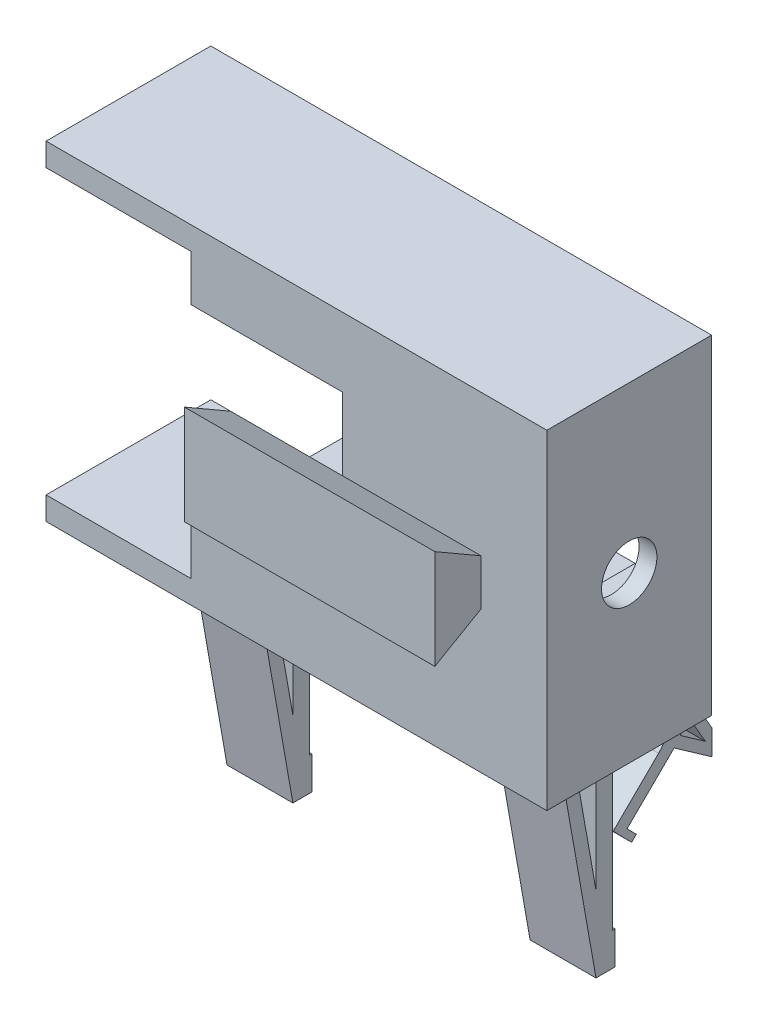
from build123d import *

# Parameters (mm, degrees)
SKETCH1_W                       = 38
SKETCH1_H                       = 50
BOSS_EXTRUDE1_DEPTH             = 25
BOSS_EXTRUDE8_DEPTH             = 10
FILLET1_R                       = 0.3
FILLET1_OF_MIRROR1_R            = 0.3
CUT_EXTRUDE7_REACH              = 77.873
SKETCH15_W                      = 45
SKETCH15_H                      = 29
BOSS_EXTRUDE2_DEPTH             = 38
SKETCH16_R                      = 11.1
CUT_EXTRUDE8_DEPTH              = 3.5
SKETCH17_R                      = 6.05
CUT_EXTRUDE9_DEPTH              = 19
CUT_EXTRUDE10_DEPTH             = 5.8
CUT_EXTRUDE11_START             = -15.8
CUT_EXTRUDE11_DEPTH             = 15.8
SKETCH20_R                      = 1.85
CUT_EXTRUDE12_DEPTH             = 19
CIRPATTERN1_COUNT               = 2
CIRPATTERN1_ANGLE               = 90
CIRPATTERN1_THE_OTHER_WAY_COUNT = 2
CIRPATTERN1_THE_OTHER_WAY_ANGLE = 90
SKETCH24_W                      = 15.3
SKETCH24_H                      = 21.6
SKETCH24_R                      = 1.85
CUT_EXTRUDE13_DEPTH             = 16
SKETCH25_R                      = 4.2
CUT_EXTRUDE14_DEPTH             = 101.421935127
SKETCH27_W                      = 22
SKETCH27_H                      = 43
CUT_EXTRUDE15_DEPTH             = 25


with BuildPart() as part:
    # Sketch1 → Boss-Extrude1 (new body)
    with BuildSketch(Plane.XY):
        with Locations((-19, 0)):
            Rectangle(SKETCH1_W, SKETCH1_H)
    boss_extrude1 = extrude(amount=BOSS_EXTRUDE1_DEPTH)

    # Sketch11 → Boss-Extrude8 (add)
    with BuildSketch(Plane(origin=(-28, 0, 0), x_dir=(0, 0, -1), z_dir=(1, 0, 0))):
        with BuildLine():
            Line((-5.0442209, -55.726230367), (-5.0442209, -29.776230367))
            ThreePointArc((-5.0442209, -29.776230367), (-4.776271708, -28.776230367), (-4.0442209, -28.044179559))
            ThreePointArc((-4.0442209, -28.044179559), (2.432940548, -29.34409424), (1.9670283, -35.933959519))
            Line((1.9670283, -35.933959519), (-4.9442209, -42.751230367))
            Line((-4.9442209, -42.751230367), (-2.13522154, -45.598952719))
            Line((-2.13522154, -45.598952719), (-1.423290952, -44.896702879))
            Line((-1.423290952, -44.896702879), (-2.827790632, -43.472841703))
            Line((-2.827790632, -43.472841703), (4.31462396, -36.427548823))
            Line((4.31462396, -36.427548823), (10.04868827, -40.442583877))
            Line((10.04868827, -40.442583877), (10.04868827, -36.637851334))
            Line((10.04868827, -36.637851334), (5.379165125, -28.55))
            ThreePointArc((5.379165125, -28.55), (3.107671966, -26.234387817), (0, -25.304809472))
            Line((0, -25.304809472), (0, -25))
            Line((0, -25), (-0.5, -25))
            Line((-0.5, -25), (-0.5, -25.304809472))
            ThreePointArc((-0.5, -25.304809472), (-2.379635768, -25.65877443), (-4.074871702, -26.544492749))
            ThreePointArc((-4.074871702, -26.544492749), (-5.891365223, -28.673957334), (-6.5442209, -31.395730211))
            Line((-6.5442209, -31.395730211), (-6.5442209, -25))
            Line((-6.5442209, -25), (-7.5442209, -25))
            Line((-7.5442209, -25), (-7.5442209, -49.208689401))
            Line((-7.5442209, -49.208689401), (-11.812866009, -25))
            Line((-11.812866009, -25), (-13.843719233, -25))
            Line((-13.843719233, -25), (-7.5442209, -60.726230367))
            Line((-7.5442209, -60.726230367), (-4.6442209, -60.726230367))
            Line((-4.6442209, -60.726230367), (-4.6442209, -55.726230367))
            Line((-4.6442209, -55.726230367), (-5.0442209, -55.726230367))
        make_face()
        with BuildLine():
            ThreePointArc((5.255569039, -35.255243777), (5.821779814, -34.120234879), (6.156782985, -32.896873642))
            Line((6.156782985, -32.896873642), (9.053935122, -37.914888341))
            Line((9.053935122, -37.914888341), (5.255569039, -35.255243777))
        make_face(mode=Mode.SUBTRACT)
    boss_extrude8 = extrude(amount=BOSS_EXTRUDE8_DEPTH)

    # Fillet1
    fillet1_edges = [part.edges().sort_by_distance(p)[0] for p in [
        (-23, -42.751230367, 4.9442209),
    ]]
    fillet(fillet1_edges, radius=FILLET1_R)

    # Mirror1: Boss-Extrude1, Boss-Extrude8 across plane
    add(boss_extrude1.mirror(Plane(origin=(0, 0, 0), x_dir=(0, 0, 1), z_dir=(1, 0, 0))))
    add(boss_extrude8.mirror(Plane(origin=(0, 0, 0), x_dir=(0, 0, 1), z_dir=(1, 0, 0))))

    # Fillet1 of Mirror1
    fillet1_of_mirror1_edges = [part.edges().sort_by_distance(p)[0] for p in [
        (23, -42.751230367, 4.9442209),
    ]]
    fillet(fillet1_of_mirror1_edges, radius=FILLET1_OF_MIRROR1_R)

    # Sketch15 → Cut-Extrude7 (cut, up to next)
    with BuildSketch(Plane(origin=(0, 0, 0), x_dir=(-1, 0, 0), z_dir=(0, 0, -1)), mode=Mode.PRIVATE) as cut_extrude7_sk1:
        with Locations((15.5, 0)):
            Rectangle(SKETCH15_W, SKETCH15_H)
    cut_extrude7_tool1 = extrude(cut_extrude7_sk1.sketch, amount=-CUT_EXTRUDE7_REACH, mode=Mode.PRIVATE) & part.part
    add(cut_extrude7_tool1.solids().sort_by_distance((-15.5, 0, 0))[0], mode=Mode.SUBTRACT)

    # Sketch2 → Boss-Extrude2 (add)
    with BuildSketch(Plane.ZY.offset(-28)):
        Polygon((32, 7.541451884), (25, 3.5), (25, -3.5), (32, -7.541451884), align=None)
    extrude(amount=BOSS_EXTRUDE2_DEPTH)

    # Sketch16 → Cut-Extrude8 (cut)
    with BuildSketch(Plane.ZY.offset(-7)):
        with Locations((12.5, 0)):
            Circle(SKETCH16_R)
    extrude(amount=-CUT_EXTRUDE8_DEPTH, mode=Mode.SUBTRACT)

    # Sketch17 → Cut-Extrude9 (cut)
    with BuildSketch(Plane.ZY.offset(-10.5)):
        with Locations((12.5, 0)):
            Circle(SKETCH17_R)
    extrude(amount=-CUT_EXTRUDE9_DEPTH, mode=Mode.SUBTRACT)

    # Sketch18 → Cut-Extrude10 (cut)
    with BuildSketch(Plane.ZY.offset(-29.5)):
        with BuildLine():
            Line((0, -7.5), (12.5, -7.5))
            ThreePointArc((12.5, -7.5), (20, 0), (12.5, 7.5))
            Line((12.5, 7.5), (0, 7.5))
            Line((0, 7.5), (0, -7.5))
        make_face()
    extrude(amount=-CUT_EXTRUDE10_DEPTH, mode=Mode.SUBTRACT)

    # Sketch19 → Cut-Extrude11 (cut)
    with BuildSketch(Plane(origin=(29.5, 0, 0), x_dir=(0, 0, -1), z_dir=(1, 0, 0)).offset(CUT_EXTRUDE11_START)):
        with BuildLine():
            Line((-12.5, 6.05), (0, 6.05))
            Line((0, 6.05), (0, -6.05))
            Line((0, -6.05), (-12.5, -6.05))
            ThreePointArc((-12.5, -6.05), (-18.55, 0), (-12.5, 6.05))
        make_face()
    extrude(amount=CUT_EXTRUDE11_DEPTH, mode=Mode.SUBTRACT)

    # Sketch20 → Cut-Extrude12 (cut)
    with BuildSketch(Plane.ZY.offset(-10.5)):
        with Locations((4.5, 0)):
            Circle(SKETCH20_R)
    cut_extrude12 = extrude(amount=-CUT_EXTRUDE12_DEPTH, mode=Mode.SUBTRACT)

    # CirPattern1: Cut-Extrude12 ×2 about axis
    cirpattern1_axis = Axis((29.5, 0, 12.5), (-1, 0, 0))
    for i in range(1, CIRPATTERN1_COUNT):
        add(cut_extrude12.rotate(cirpattern1_axis, i * CIRPATTERN1_ANGLE / (CIRPATTERN1_COUNT - 1)), mode=Mode.SUBTRACT)

    # CirPattern1 the other way: Cut-Extrude12 ×2 about axis
    cirpattern1_the_other_way_axis = Axis((29.5, 0, 12.5), (1, 0, 0))
    for i in range(1, CIRPATTERN1_THE_OTHER_WAY_COUNT):
        add(cut_extrude12.rotate(cirpattern1_the_other_way_axis, i * CIRPATTERN1_THE_OTHER_WAY_ANGLE / (CIRPATTERN1_THE_OTHER_WAY_COUNT - 1)), mode=Mode.SUBTRACT)

    # Sketch24 → Cut-Extrude13 (cut)
    with BuildSketch(Plane(origin=(13.7, 0, 0), x_dir=(0, 0, -1), z_dir=(1, 0, 0))):
        with Locations((-7.65, 0)):
            Rectangle(SKETCH24_W, SKETCH24_H)
        with Locations((-12.5, -8)):
            Circle(SKETCH24_R, mode=Mode.SUBTRACT)
        with Locations((-12.5, 8)):
            Circle(SKETCH24_R, mode=Mode.SUBTRACT)
    extrude(amount=CUT_EXTRUDE13_DEPTH, mode=Mode.SUBTRACT)

    # Sketch25 → Cut-Extrude14 (cut, through all)
    with BuildSketch(Plane.ZY.offset(-35.3)):
        with Locations((12.5, 0)):
            Circle(SKETCH25_R)
    extrude(amount=-CUT_EXTRUDE14_DEPTH, mode=Mode.SUBTRACT)

    # Sketch27 → Cut-Extrude15 (cut)
    with BuildSketch(Plane(origin=(0, 0, 0), x_dir=(-1, 0, 0), z_dir=(0, 0, -1))):
        with Locations((27, 0)):
            Rectangle(SKETCH27_W, SKETCH27_H)
    extrude(amount=-CUT_EXTRUDE15_DEPTH, mode=Mode.SUBTRACT)


solid = part.part
